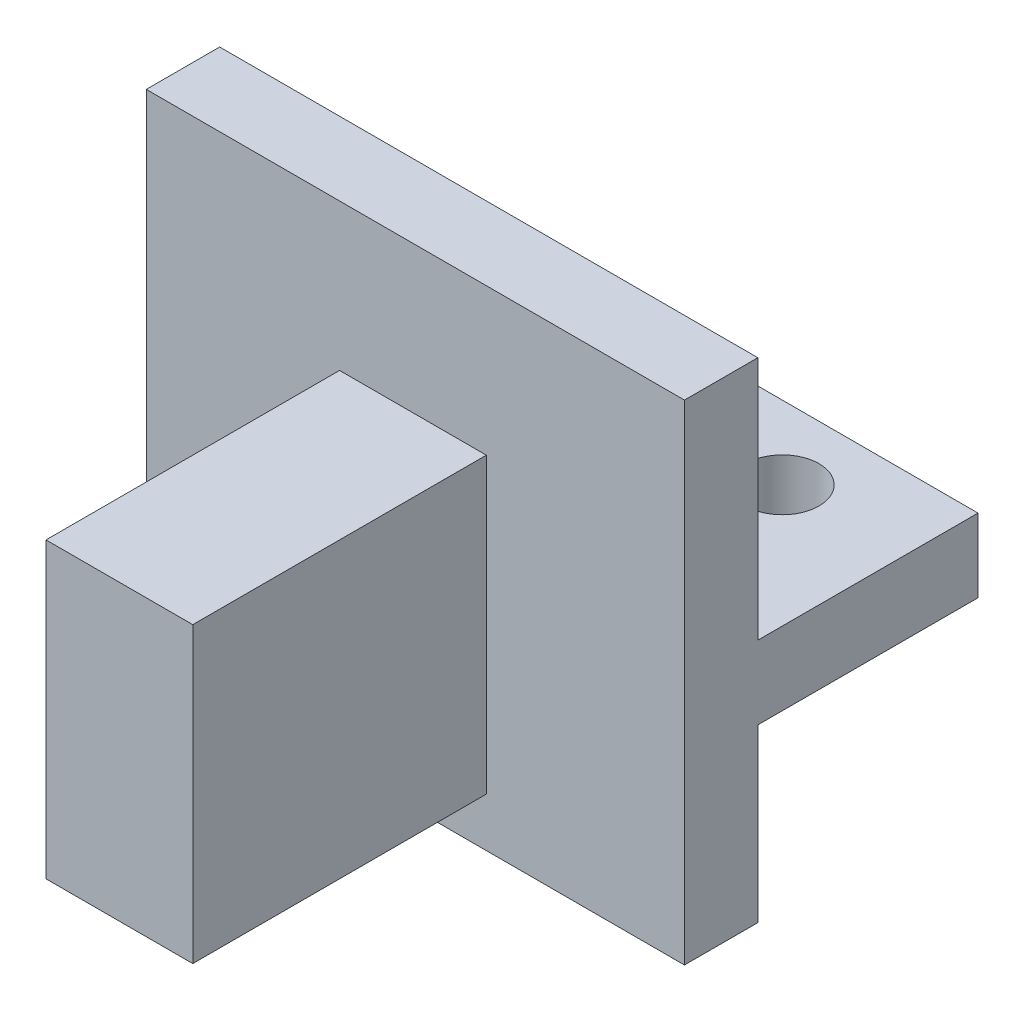
from build123d import *

# Parameters (mm, degrees)
ESQUISSE1_W        = 22
ESQUISSE1_H        = 7
ESQUISSE1_R        = 1.5
BOSS_EXTRU_1_DEPTH = 3
ESQUISSE4_W        = 22
ESQUISSE4_H        = 3
BOSS_EXTRU_2_DEPTH = 5
ESQUISSE5_W        = 22
ESQUISSE5_H        = 3
BOSS_EXTRU_3_DEPTH = 10
ESQUISSE6_W        = 22
ESQUISSE6_H        = 3
BOSS_EXTRU_4_DEPTH = 7
ESQUISSE7_W        = 6
ESQUISSE7_H        = 12
BOSS_EXTRU_5_DEPTH = 12


with BuildPart() as part:
    # Esquisse1 → Boss.-Extru.1 (new body)
    with BuildSketch(Plane(origin=(0, 0, 0), x_dir=(1, 0, 0), z_dir=(0, 1, 0))):
        with Locations((2.109278351, -1.693814433)):
            Rectangle(ESQUISSE1_W, ESQUISSE1_H)
        with Locations(Location((-3.890721649, -1.193814433, 0), (0, 0, 270))):
            Circle(ESQUISSE1_R, mode=Mode.SUBTRACT)
        with Locations(Location((8.109278351, -1.193814433, 0), (0, 0, 90))):
            Circle(ESQUISSE1_R, mode=Mode.SUBTRACT)
    extrude(amount=BOSS_EXTRU_1_DEPTH)

    # Esquisse4 → Boss.-Extru.2 (add)
    with BuildSketch(Plane.XY.offset(5.193814433)):
        with Locations((2.109278351, 1.5)):
            Rectangle(ESQUISSE4_W, ESQUISSE4_H)
    extrude(amount=BOSS_EXTRU_2_DEPTH)

    # Esquisse5 → Boss.-Extru.3 (add)
    with BuildSketch(Plane(origin=(0, 3, 0), x_dir=(1, 0, 0), z_dir=(0, 1, 0))):
        with Locations((2.109278351, -8.693814433)):
            Rectangle(ESQUISSE5_W, ESQUISSE5_H)
    extrude(amount=BOSS_EXTRU_3_DEPTH)

    # Esquisse6 → Boss.-Extru.4 (add)
    with BuildSketch(Plane.XZ):
        with Locations((2.109278351, 8.693814433)):
            Rectangle(ESQUISSE6_W, ESQUISSE6_H)
    extrude(amount=BOSS_EXTRU_4_DEPTH)

    # Esquisse7 → Boss.-Extru.5 (add)
    with BuildSketch(Plane.XY.offset(10.193814433)):
        with Locations((2.009802238, 1)):
            Rectangle(ESQUISSE7_W, ESQUISSE7_H)
    extrude(amount=BOSS_EXTRU_5_DEPTH)


solid = part.part
